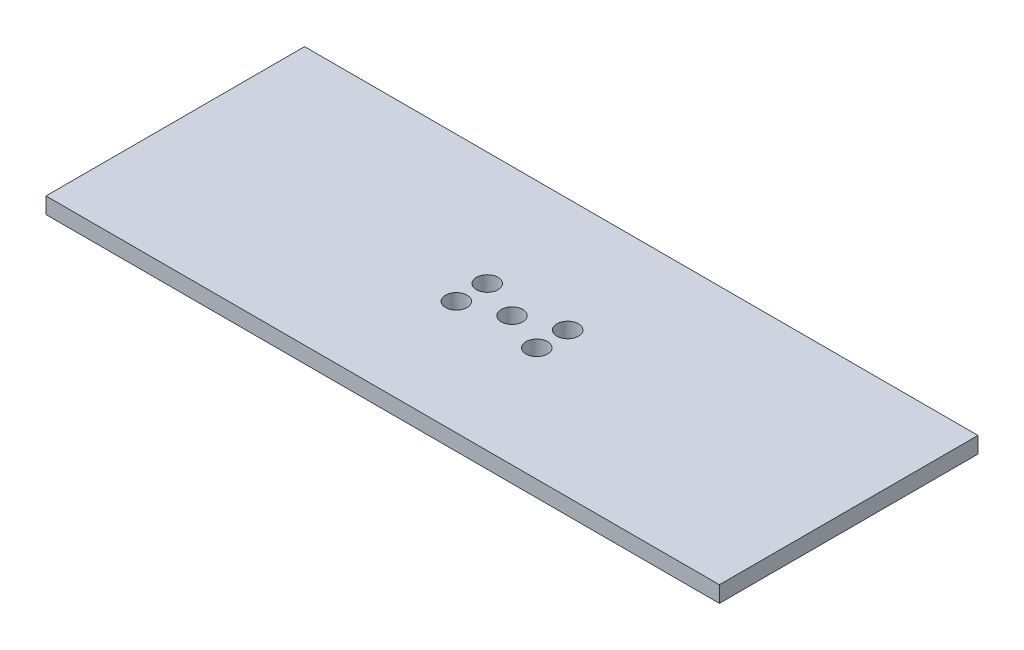
from build123d import *

# Parameters (mm, degrees)
SKETCH1_W           = 125
SKETCH1_H           = 48
SKETCH1_R           = 2
BOSS_EXTRUDE1_DEPTH = 3


with BuildPart() as part:
    # Sketch1 → Boss-Extrude1 (new body)
    with BuildSketch(Plane(origin=(0, 0, 0), x_dir=(1, 0, 0), z_dir=(0, 1, 0))):
        Rectangle(SKETCH1_W, SKETCH1_H)
        with Locations(Location((0, 0, 0), (0, 0, 270))):
            Circle(SKETCH1_R, mode=Mode.SUBTRACT)
        with Locations(Location((-7.468303633, 2.867828595, 0), (0, 0, 270))):
            Circle(SKETCH1_R, mode=Mode.SUBTRACT)
        with Locations(Location((7.468303633, -2.867828595, 0), (0, 0, 270))):
            Circle(SKETCH1_R, mode=Mode.SUBTRACT)
        with Locations(Location((-7.468303633, -2.867828595, 0), (0, 0, 270))):
            Circle(SKETCH1_R, mode=Mode.SUBTRACT)
        with Locations(Location((7.468303633, 2.867828595, 0), (0, 0, 270))):
            Circle(SKETCH1_R, mode=Mode.SUBTRACT)
    extrude(amount=BOSS_EXTRUDE1_DEPTH)


solid = part.part
